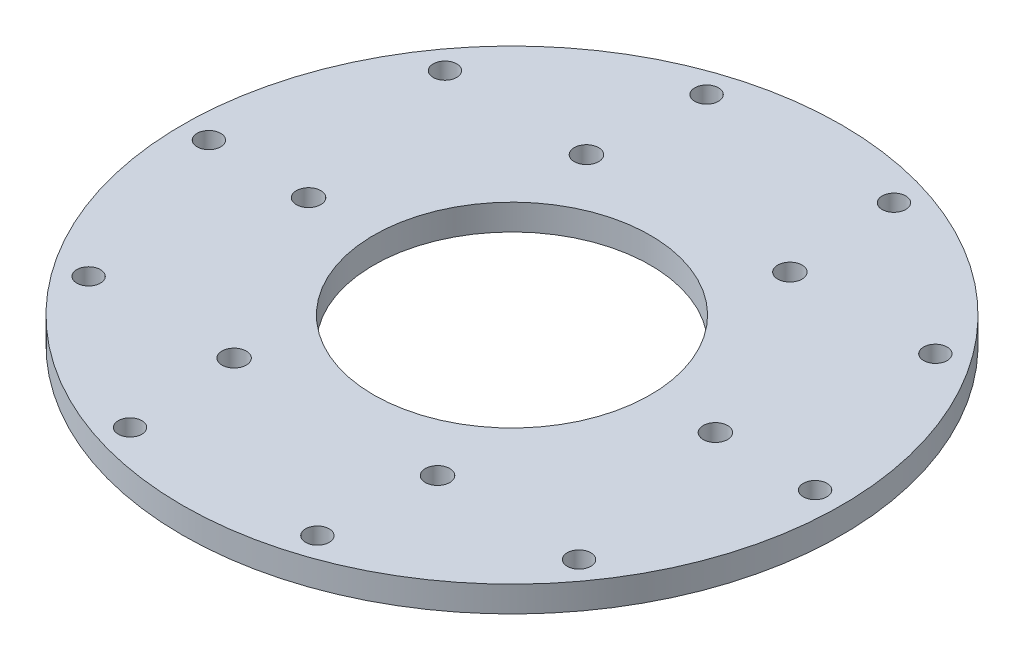
from build123d import *

# Parameters (mm, degrees)
SKETCH2_R           = 40.5
SKETCH2_R_2         = 17
SKETCH2_R_3         = 1.45
SKETCH2_R_4         = 1.5
BOSS_EXTRUDE1_DEPTH = 3.175


with BuildPart() as part:
    # Sketch2 → Boss-Extrude1 (new body)
    with BuildSketch(Plane(origin=(0, 0, 0), x_dir=(1, 0, 0), z_dir=(0, 1, 0))):
        with Locations(Location((0, 0, 0), (0, 0, 270))):
            Circle(SKETCH2_R)
        with Locations(Location((0, 0, 0), (0, 0, 270))):
            Circle(SKETCH2_R_2, mode=Mode.SUBTRACT)
        with Locations(Location((-37.25, 0, 0), (0, 0, 270))):
            Circle(SKETCH2_R_3, mode=Mode.SUBTRACT)
        with Locations(Location((-25, 0, 0), (0, 0, 270))):
            Circle(SKETCH2_R_4, mode=Mode.SUBTRACT)
        with Locations(Location((-12.5, 21.650635095, 0), (0, 0, 270))):
            Circle(SKETCH2_R_4, mode=Mode.SUBTRACT)
        with Locations(Location((12.5, 21.650635095, 0), (0, 0, 270))):
            Circle(SKETCH2_R_4, mode=Mode.SUBTRACT)
        with Locations(Location((25, 0, 0), (0, 0, 270))):
            Circle(SKETCH2_R_4, mode=Mode.SUBTRACT)
        with Locations(Location((12.5, -21.650635095, 0), (0, 0, 270))):
            Circle(SKETCH2_R_4, mode=Mode.SUBTRACT)
        with Locations(Location((-12.5, -21.650635095, 0), (0, 0, 270))):
            Circle(SKETCH2_R_4, mode=Mode.SUBTRACT)
        with Locations(Location((-30.13588304, 21.895000648, 0), (0, 0, 270))):
            Circle(SKETCH2_R_3, mode=Mode.SUBTRACT)
        with Locations(Location((-11.51088304, 35.426855232, 0), (0, 0, 270))):
            Circle(SKETCH2_R_3, mode=Mode.SUBTRACT)
        with Locations(Location((11.51088304, 35.426855232, 0), (0, 0, 270))):
            Circle(SKETCH2_R_3, mode=Mode.SUBTRACT)
        with Locations(Location((30.13588304, 21.895000648, 0), (0, 0, 270))):
            Circle(SKETCH2_R_3, mode=Mode.SUBTRACT)
        with Locations(Location((37.25, 0, 0), (0, 0, 270))):
            Circle(SKETCH2_R_3, mode=Mode.SUBTRACT)
        with Locations(Location((30.13588304, -21.895000648, 0), (0, 0, 270))):
            Circle(SKETCH2_R_3, mode=Mode.SUBTRACT)
        with Locations(Location((11.51088304, -35.426855232, 0), (0, 0, 270))):
            Circle(SKETCH2_R_3, mode=Mode.SUBTRACT)
        with Locations(Location((-11.51088304, -35.426855232, 0), (0, 0, 270))):
            Circle(SKETCH2_R_3, mode=Mode.SUBTRACT)
        with Locations(Location((-30.13588304, -21.895000648, 0), (0, 0, 270))):
            Circle(SKETCH2_R_3, mode=Mode.SUBTRACT)
    extrude(amount=BOSS_EXTRUDE1_DEPTH)


solid = part.part
